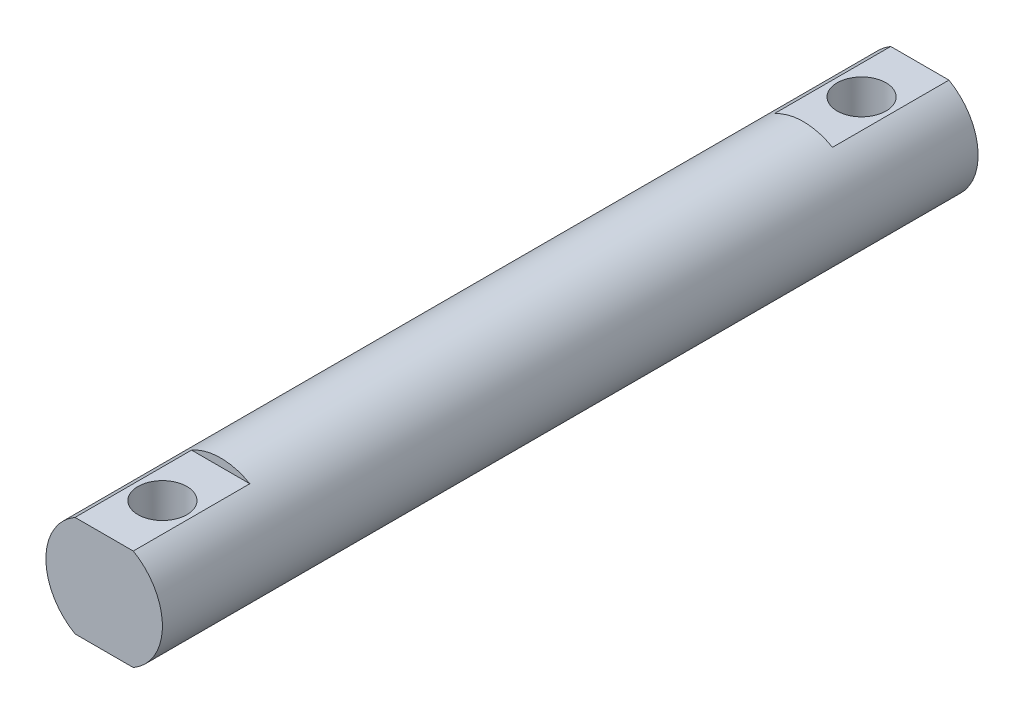
from build123d import *

# Parameters (mm, degrees)
SKETCH_1_R          = 5
EXTRUDE_1_DEPTH     = 70
SKETCH_2_R          = 2.1
CUT_EXTRUDE_1_DEPTH = 5
SKETCH_3_W          = 5
SKETCH_3_H          = 10
CUT_EXTRUDE_2_DEPTH = 10
SKETCH_4_W          = 5
SKETCH_4_H          = 10
CUT_EXTRUDE_3_DEPTH = 10


with BuildPart() as part:
    # 草图1 → 凸台-拉伸1 (new body)
    with BuildSketch(Plane.XY):
        Circle(SKETCH_1_R)
    extrude(amount=EXTRUDE_1_DEPTH)

    # 草图2 → 切除-拉伸1 (cut, symmetric)
    with BuildSketch(Plane(origin=(0, 0, 0), x_dir=(1, 0, 0), z_dir=(0, 1, 0))):
        with Locations(Location((0, -5, 0), (0, 0, 270))):
            Circle(SKETCH_2_R)
        with Locations(Location((0, -65, 0), (0, 0, 270))):
            Circle(SKETCH_2_R)
    extrude(amount=CUT_EXTRUDE_1_DEPTH, both=True, mode=Mode.SUBTRACT)

    # 草图3 → 切除-拉伸2 (cut)
    with BuildSketch(Plane.XY.offset(70)):
        with Locations((0, 9.330127019)):
            Rectangle(SKETCH_3_W, SKETCH_3_H)
        with Locations((0, -9.330127019)):
            Rectangle(SKETCH_3_W, SKETCH_3_H)
    extrude(amount=-CUT_EXTRUDE_2_DEPTH, mode=Mode.SUBTRACT)

    # 草图4 → 切除-拉伸3 (cut)
    with BuildSketch(Plane(origin=(0, 0, 0), x_dir=(-1, 0, 0), z_dir=(0, 0, -1))):
        with Locations((0, 9.330127019)):
            Rectangle(SKETCH_4_W, SKETCH_4_H)
        with Locations((0, -9.330127019)):
            Rectangle(SKETCH_4_W, SKETCH_4_H)
    extrude(amount=-CUT_EXTRUDE_3_DEPTH, mode=Mode.SUBTRACT)


solid = part.part
